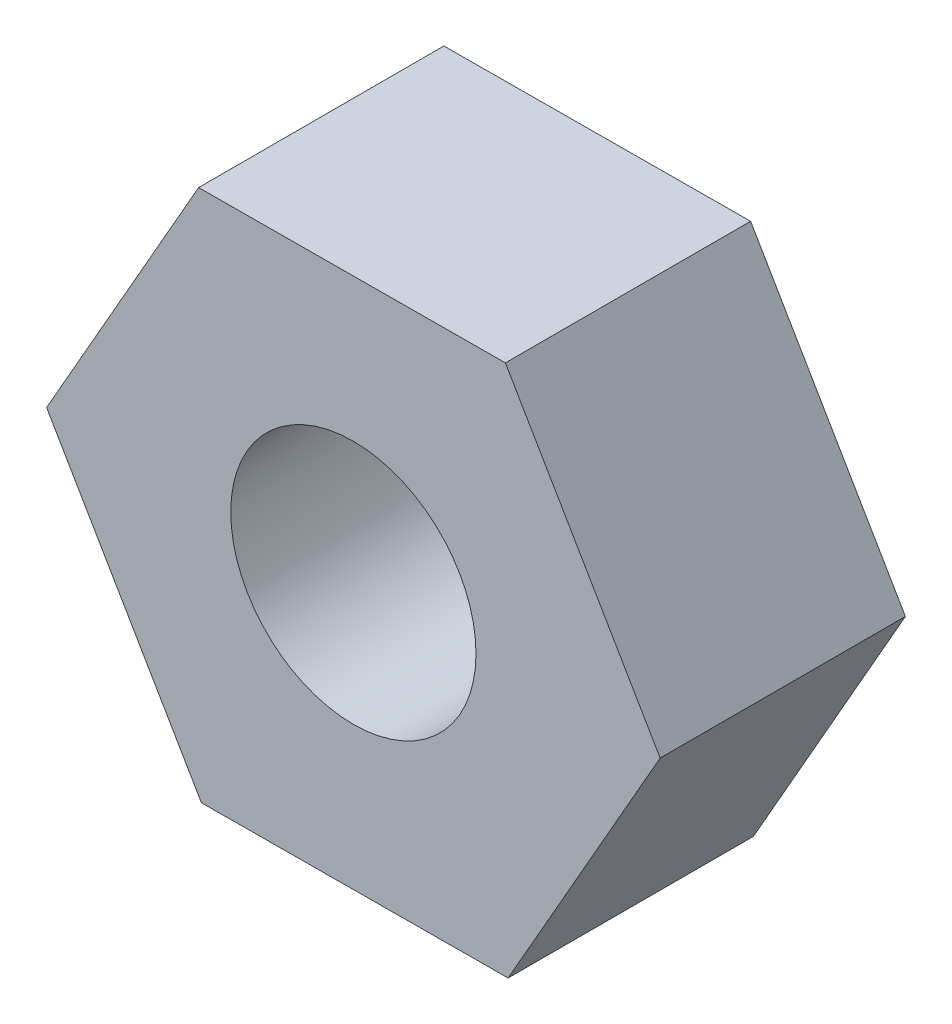
from build123d import *

# Parameters (mm, degrees)
SKETCH1_R           = 6
BOSS_EXTRUDE1_DEPTH = 12


with BuildPart() as part:
    # Sketch1 → Boss-Extrude1 (new body)
    with BuildSketch(Plane.XY):
        Polygon((-13.390210882, -4.996930009), (-5.952575928, 8.042282782), (-13.526047972, 21.003069991), (-28.537154971, 20.924644411), (-35.974789926, 7.885431621), (-28.401317881, -5.075355589), align=None)
        with Locations((-20.963682927, 7.963857201)):
            Circle(SKETCH1_R, mode=Mode.SUBTRACT)
    extrude(amount=-BOSS_EXTRUDE1_DEPTH)


solid = part.part
